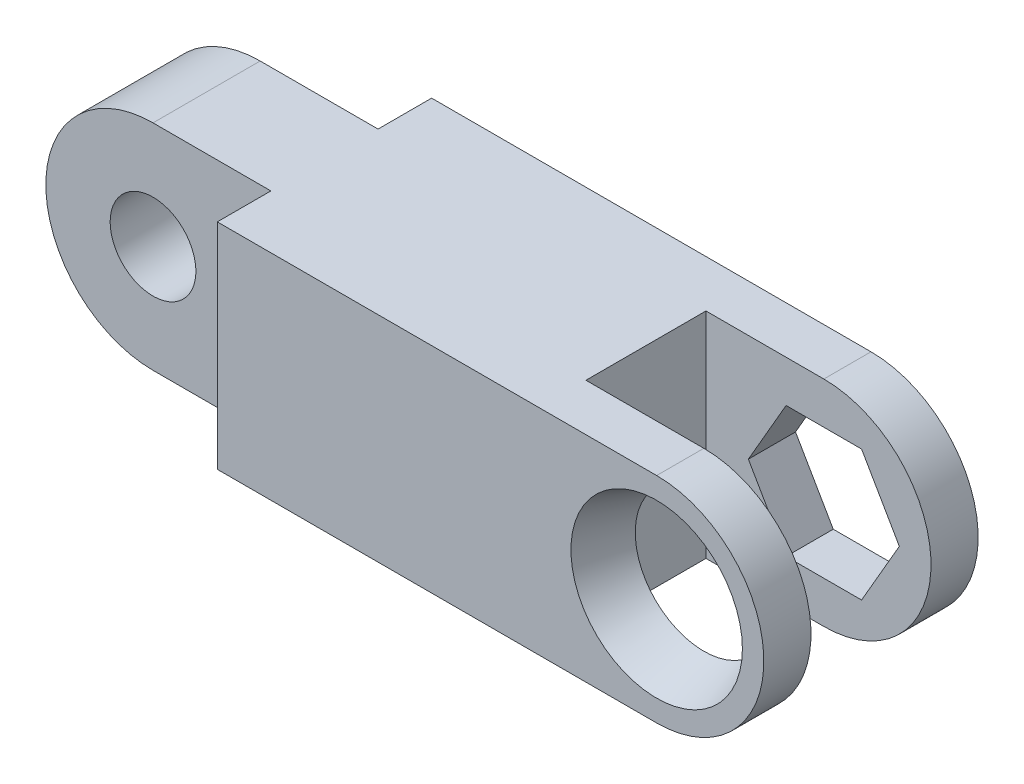
from build123d import *

# Parameters (mm, degrees)
EXTRUDE_1_DEPTH     = 10
SKETCH_3_W          = 10.5
SKETCH_3_H          = 5.6
CUT_EXTRUDE_2_DEPTH = 23.891046285
SKETCH_4_W          = 10.5
SKETCH_4_H          = 2.5
CUT_EXTRUDE_3_DEPTH = 23.891046285
SKETCH_2_R          = 4
CUT_EXTRUDE_4_DEPTH = 3
CUT_EXTRUDE_4_DRAFT = -20
CUT_EXTRUDE_5_DEPTH = 2.5
SKETCH_9_R          = 2
CUT_EXTRUDE_8_DEPTH = 9


with BuildPart() as part:
    # 草圖1 → 填料-伸長1 (new body)
    with BuildSketch(Plane.XY):
        with BuildLine():
            Line((-13, -5), (13, -5))
            ThreePointArc((13, -5), (18, 0), (13, 5))
            Line((13, 5), (-13, 5))
            ThreePointArc((-13, 5), (-18, 0), (-13, -5))
        make_face()
    extrude(amount=EXTRUDE_1_DEPTH)

    # 草圖3 → 除料-伸長2 (cut, through all)
    with BuildSketch(Plane(origin=(0, 5, 0), x_dir=(1, 0, 0), z_dir=(0, 1, 0))):
        with Locations((12.75, -5)):
            Rectangle(SKETCH_3_W, SKETCH_3_H)
    extrude(amount=-CUT_EXTRUDE_2_DEPTH, mode=Mode.SUBTRACT)

    # 草圖4 → 除料-伸長3 (cut, through all)
    with BuildSketch(Plane(origin=(0, 5, 0), x_dir=(1, 0, 0), z_dir=(0, 1, 0))):
        with Locations((-12.75, -1.25)):
            Rectangle(SKETCH_4_W, SKETCH_4_H)
        with Locations((-12.75, -8.75)):
            Rectangle(SKETCH_4_W, SKETCH_4_H)
    extrude(amount=-CUT_EXTRUDE_3_DEPTH, mode=Mode.SUBTRACT)


with BuildPart() as cut_extrude_4_tool:
    # 草圖2 → 除料-伸長4 (with draft: the straight prism first)
    with BuildSketch(Plane.XY.offset(10)):
        with Locations((13, 0)):
            Circle(SKETCH_2_R)
    extrude(amount=-CUT_EXTRUDE_4_DEPTH)
    # 除料-伸長4: the draft: its side faces are tilted about the plane it starts from
    cut_extrude_4_sides = [cut_extrude_4_tool.faces().sort_by_distance(p)[0] for p in [
        (9, 0, 8.5),
    ]]
    draft(cut_extrude_4_sides, Plane.XY.offset(10), CUT_EXTRUDE_4_DRAFT)


with BuildPart() as part_1:
    add(part.part)

    # 除料-伸長4: cut by cut_extrude_4_tool
    add(cut_extrude_4_tool.part, mode=Mode.SUBTRACT)

    # 草圖5 → 除料-伸長5 (cut)
    with BuildSketch(Plane(origin=(0, 0, 0), x_dir=(-1, 0, 0), z_dir=(0, 0, -1))):
        Polygon((-16.521836642, 0), (-14.760918321, -3.05), (-11.239081679, -3.05), (-9.478163358, 0), (-11.239081679, 3.05), (-14.760918321, 3.05), align=None)
    extrude(amount=-CUT_EXTRUDE_5_DEPTH, mode=Mode.SUBTRACT)

    # 草圖9 → 除料-伸長8 (cut)
    with BuildSketch(Plane.XY):
        with Locations((-13, 0)):
            Circle(SKETCH_9_R)
    extrude(amount=CUT_EXTRUDE_8_DEPTH, mode=Mode.SUBTRACT)


solid = part_1.part
